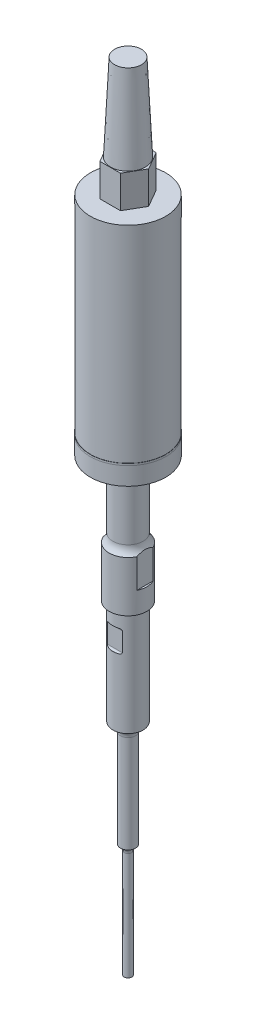
from build123d import *

# Parameters (mm, degrees)
CUT_EXTRUDE1_DEPTH      = 286.633670547
CUT_EXTRUDE1_DEPTH_BACK = 286.633670547
CUT_EXTRUDE2_DEPTH      = 286.633670547
CUT_EXTRUDE2_DEPTH_BACK = 286.633670547
BOSS_EXTRUDE1_DEPTH     = 13.7
SKETCH7_W               = 0.1
SKETCH7_H               = 0.8


with BuildPart() as part:
    # Sketch1 → Revolve1 (revolve)
    with BuildSketch(Plane.XY):
        with BuildLine():
            Line((0, 0), (15.875, 0))
            Line((15.875, 0), (15.875, -95.25))
            Line((15.875, -95.25), (7.75, -95.25))
            ThreePointArc((7.75, -95.25), (6.710108543, -97.13103799), (6.35, -99.25))
            Line((6.35, -99.25), (6.35, -123.35))
            ThreePointArc((6.35, -123.35), (6.765423592, -125.271598049), (7.9375, -126.85))
            Line((7.9375, -126.85), (7.9375, -148.15))
            Line((7.9375, -148.15), (6.35, -148.15))
            Line((6.35, -148.15), (6.35, -192.25))
            ThreePointArc((6.35, -192.25), (4.060973326, -193.504085038), (3.15, -195.95))
            Line((3.15, -195.95), (3.15, -236.95))
            ThreePointArc((3.15, -236.95), (2.021186638, -237.921495537), (1.6, -239.35))
            Line((1.6, -239.35), (1.6, -284.75))
            Line((1.6, -284.75), (0, -284.75))
            Line((0, -284.75), (0, 0))
        make_face()
    revolve(axis=Axis((0, -284.75, 0), (0, 1, 0)))

    # Sketch3 → Cut-Extrude1 (cut, two sides: drawn at the far end of the back side and taken through both)
    with BuildSketch(Plane.XY.offset(-CUT_EXTRUDE1_DEPTH_BACK)):
        with BuildLine():
            Line((7.9375, -139.15), (7.9375, -126.85))
            ThreePointArc((7.9375, -126.85), (7.511434792, -126.425239776), (7.14375, -125.949045798))
            Line((7.14375, -125.949045798), (7.14375, -139.15))
            Line((7.14375, -139.15), (7.9375, -139.15))
        make_face()
        with BuildLine():
            Line((-7.14375, -139.15), (-7.14375, -125.949045798))
            ThreePointArc((-7.14375, -125.949045798), (-7.511434792, -126.425239776), (-7.9375, -126.85))
            Line((-7.9375, -126.85), (-7.9375, -139.15))
            Line((-7.9375, -139.15), (-7.14375, -139.15))
        make_face()
    extrude(amount=CUT_EXTRUDE1_DEPTH + CUT_EXTRUDE1_DEPTH_BACK, mode=Mode.SUBTRACT)

    # Sketch4 → Cut-Extrude2 (cut, two sides: drawn at the far end of the back side and taken through both)
    with BuildSketch(Plane(origin=(0, 0, 0), x_dir=(0, 0, -1), z_dir=(1, 0, 0)).offset(-CUT_EXTRUDE2_DEPTH_BACK)):
        with BuildLine():
            Line((6.35, -163.5805), (6.2245, -163.5805))
            ThreePointArc((6.2245, -163.5805), (5.729525253, -163.375474747), (5.5245, -162.8805))
            Line((5.5245, -162.8805), (5.5245, -154.8825))
            ThreePointArc((5.5245, -154.8825), (5.729525253, -154.387525253), (6.2245, -154.1825))
            Line((6.2245, -154.1825), (6.35, -154.1825))
            Line((6.35, -154.1825), (6.35, -163.5805))
        make_face()
        with BuildLine():
            Line((-5.5245, -162.8805), (-5.5245, -154.8825))
            ThreePointArc((-5.5245, -154.8825), (-5.729525253, -154.387525253), (-6.2245, -154.1825))
            Line((-6.2245, -154.1825), (-6.35, -154.1825))
            Line((-6.35, -154.1825), (-6.35, -163.5805))
            Line((-6.35, -163.5805), (-6.2245, -163.5805))
            ThreePointArc((-6.2245, -163.5805), (-5.729525253, -163.375474747), (-5.5245, -162.8805))
        make_face()
    extrude(amount=CUT_EXTRUDE2_DEPTH + CUT_EXTRUDE2_DEPTH_BACK, mode=Mode.SUBTRACT)

    # Sketch5 → Boss-Extrude1 (add)
    with BuildSketch(Plane(origin=(0, 0, 0), x_dir=(1, 0, 0), z_dir=(0, 1, 0))):
        Polygon((-4.33708409, 7.51205), (-8.674168179, 0), (-4.33708409, -7.51205), (4.33708409, -7.51205), (8.674168179, 0), (4.33708409, 7.51205), align=None)
    extrude(amount=BOSS_EXTRUDE1_DEPTH)

    # Sketch6 → Revolve2 (revolve)
    with BuildSketch(Plane.XY, mode=Mode.PRIVATE) as revolve2_sk:
        Polygon((7.35, 13.7), (0, 13.7), (0, 50.2), (5.65, 50.2), align=None)
    revolve(revolve2_sk.sketch.rotate(Axis((0, 13.7, 0), (0, 1, 0)), 90), axis=Axis((0, 13.7, 0), (0, 1, 0)))

    # Sketch7 → Dont Clamp Below (revolve)
    with BuildSketch(Plane.XY):
        with Locations((15.925, -87.25)):
            Rectangle(SKETCH7_W, SKETCH7_H)
    revolve(axis=Axis((0, -284.75, 0), (0, 1, 0)))


solid = part.part
